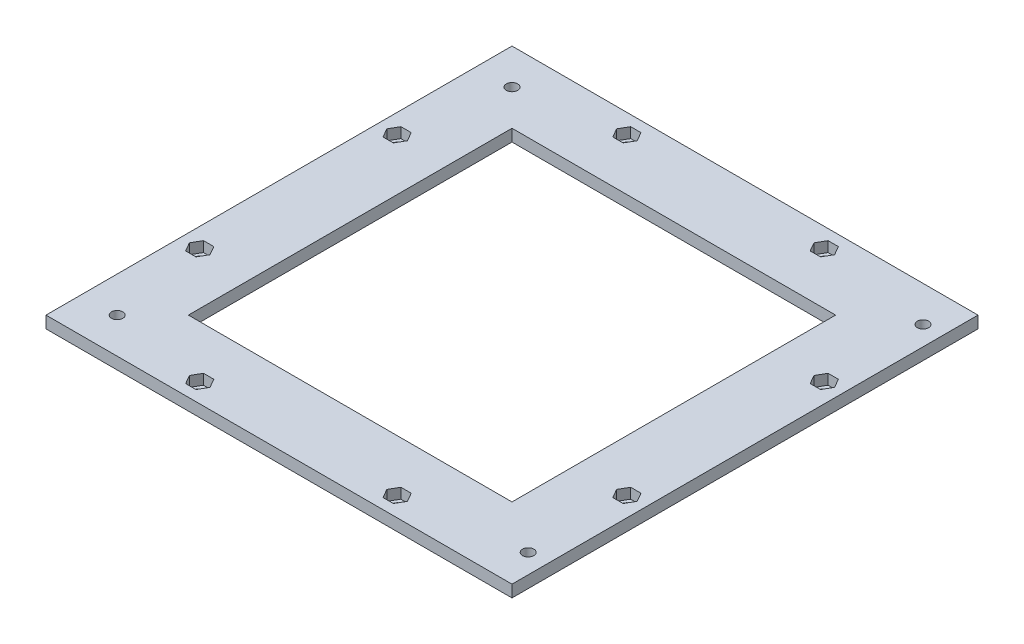
from build123d import *

# Parameters (mm, degrees)
CROQUIS1_W              = 140
CROQUIS1_H              = 140
CROQUIS1_R              = 1.5
SALIENTE_EXTRUIR1_DEPTH = 0.5
CROQUIS2_R              = 1.75
CROQUIS2_W              = 100
CROQUIS2_H              = 100
CORTAR_EXTRUIR1_DEPTH   = 10
SALIENTE_EXTRUIR3_START = 2.7
CROQUIS3_W              = 144
CROQUIS3_H              = 144
CROQUIS3_R              = 1.75
CROQUIS3_W_2            = 100
CROQUIS3_H_2            = 100
SALIENTE_EXTRUIR3_DEPTH = 2.7
CROQUIS4_W              = 144
CROQUIS4_H              = 144
CROQUIS4_W_2            = 140
CROQUIS4_H_2            = 140
SALIENTE_EXTRUIR4_DEPTH = 0.5
CROQUIS5_W              = 144
CROQUIS5_H              = 144
CROQUIS5_R              = 1.75
CROQUIS5_W_2            = 100
CROQUIS5_H_2            = 100
SALIENTE_EXTRUIR5_DEPTH = 0.5


with BuildPart() as part:
    # Croquis1 → Saliente-Extruir1 (new body)
    with BuildSketch(Plane(origin=(0, 0, 0), x_dir=(1, 0, 0), z_dir=(0, 1, 0))):
        Rectangle(CROQUIS1_W, CROQUIS1_H)
        with Locations(Location((-61, 61, 0), (0, 0, 270))):
            Circle(CROQUIS1_R, mode=Mode.SUBTRACT)
        with Locations(Location((66, 61, 0), (0, 0, 270))):
            Circle(CROQUIS1_R, mode=Mode.SUBTRACT)
        with Locations(Location((66, -61, 0), (0, 0, 270))):
            Circle(CROQUIS1_R, mode=Mode.SUBTRACT)
        with Locations(Location((-61, -61, 0), (0, 0, 270))):
            Circle(CROQUIS1_R, mode=Mode.SUBTRACT)
        with Locations(Location((66, 30.5, 0), (0, 0, 270))):
            Circle(CROQUIS1_R, mode=Mode.SUBTRACT)
        with Locations(Location((66, -30.5, 0), (0, 0, 270))):
            Circle(CROQUIS1_R, mode=Mode.SUBTRACT)
        with Locations(Location((-30.5, -66, 0), (0, 0, 270))):
            Circle(CROQUIS1_R, mode=Mode.SUBTRACT)
        with Locations(Location((30.5, -66, 0), (0, 0, 270))):
            Circle(CROQUIS1_R, mode=Mode.SUBTRACT)
        with Locations(Location((-30.5, 66, 0), (0, 0, 90))):
            Circle(CROQUIS1_R, mode=Mode.SUBTRACT)
        with Locations(Location((30.5, 66, 0), (0, 0, 90))):
            Circle(CROQUIS1_R, mode=Mode.SUBTRACT)
        with Locations(Location((-66, 30.5, 0), (0, 0, 90))):
            Circle(CROQUIS1_R, mode=Mode.SUBTRACT)
        with Locations(Location((-66, -30.5, 0), (0, 0, 90))):
            Circle(CROQUIS1_R, mode=Mode.SUBTRACT)
    extrude(amount=SALIENTE_EXTRUIR1_DEPTH)

    # Croquis2 → Cortar-Extruir1 (cut)
    with BuildSketch(Plane(origin=(0, 0.5, 0), x_dir=(1, 0, 0), z_dir=(0, 1, 0))):
        with Locations(Location((66, 61, 0), (0, 0, 270))):
            Circle(CROQUIS2_R)
        with Locations(Location((-61, 61, 0), (0, 0, 270))):
            Circle(CROQUIS2_R)
        with Locations(Location((-61, -61, 0), (0, 0, 270))):
            Circle(CROQUIS2_R)
        with Locations(Location((66, -61, 0), (0, 0, 270))):
            Circle(CROQUIS2_R)
        Polygon((-28.906513257, 63.24), (-27.313026514, 66), (-28.906513257, 68.76), (-32.093486743, 68.76), (-33.686973486, 66), (-32.093486743, 63.24), align=None)
        Polygon((32.093486743, 63.24), (33.686973486, 66), (32.093486743, 68.76), (28.906513257, 68.76), (27.313026514, 66), (28.906513257, 63.24), align=None)
        Polygon((67.593486743, 27.74), (69.186973486, 30.5), (67.593486743, 33.26), (64.406513257, 33.26), (62.813026514, 30.5), (64.406513257, 27.74), align=None)
        Polygon((67.593486743, -33.26), (69.186973486, -30.5), (67.593486743, -27.74), (64.406513257, -27.74), (62.813026514, -30.5), (64.406513257, -33.26), align=None)
        Polygon((32.093486743, -68.76), (33.686973486, -66), (32.093486743, -63.24), (28.906513257, -63.24), (27.313026514, -66), (28.906513257, -68.76), align=None)
        Polygon((-28.906513257, -68.76), (-27.313026514, -66), (-28.906513257, -63.24), (-32.093486743, -63.24), (-33.686973486, -66), (-32.093486743, -68.76), align=None)
        Polygon((-64.406513257, -33.26), (-62.813026514, -30.5), (-64.406513257, -27.74), (-67.593486743, -27.74), (-69.186973486, -30.5), (-67.593486743, -33.26), align=None)
        Polygon((-64.406513257, 27.74), (-62.813026514, 30.5), (-64.406513257, 33.26), (-67.593486743, 33.26), (-69.186973486, 30.5), (-67.593486743, 27.74), align=None)
        Rectangle(CROQUIS2_W, CROQUIS2_H)
    extrude(amount=-CORTAR_EXTRUIR1_DEPTH, mode=Mode.SUBTRACT)

    # Croquis3 → Saliente-Extruir3 (add)
    with BuildSketch(Plane(origin=(0, 0.5, 0), x_dir=(1, 0, 0), z_dir=(0, 1, 0)).offset(SALIENTE_EXTRUIR3_START)):
        Rectangle(CROQUIS3_W, CROQUIS3_H)
        with Locations(Location((-61, -61, 0), (0, 0, 270))):
            Circle(CROQUIS3_R, mode=Mode.SUBTRACT)
        with Locations(Location((-61, 61, 0), (0, 0, 270))):
            Circle(CROQUIS3_R, mode=Mode.SUBTRACT)
        with Locations(Location((66, 61, 0), (0, 0, 270))):
            Circle(CROQUIS3_R, mode=Mode.SUBTRACT)
        with Locations(Location((66, -61, 0), (0, 0, 270))):
            Circle(CROQUIS3_R, mode=Mode.SUBTRACT)
        Rectangle(CROQUIS3_W_2, CROQUIS3_H_2, mode=Mode.SUBTRACT)
        Polygon((-33.686973486, -66), (-32.093486743, -68.76), (-28.906513257, -68.76), (-27.313026514, -66), (-28.906513257, -63.24), (-32.093486743, -63.24), align=None, mode=Mode.SUBTRACT)
        Polygon((-67.593486743, -33.26), (-64.406513257, -33.26), (-62.813026514, -30.5), (-64.406513257, -27.74), (-67.593486743, -27.74), (-69.186973486, -30.5), align=None, mode=Mode.SUBTRACT)
        Polygon((28.906513257, 63.24), (32.093486743, 63.24), (33.686973486, 66), (32.093486743, 68.76), (28.906513257, 68.76), (27.313026514, 66), align=None, mode=Mode.SUBTRACT)
        Polygon((-33.686973486, 66), (-32.093486743, 63.24), (-28.906513257, 63.24), (-27.313026514, 66), (-28.906513257, 68.76), (-32.093486743, 68.76), align=None, mode=Mode.SUBTRACT)
        Polygon((62.813026514, 30.5), (64.406513257, 27.74), (67.593486743, 27.74), (69.186973486, 30.5), (67.593486743, 33.26), (64.406513257, 33.26), align=None, mode=Mode.SUBTRACT)
        Polygon((67.593486743, -33.26), (69.186973486, -30.5), (67.593486743, -27.74), (64.406513257, -27.74), (62.813026514, -30.5), (64.406513257, -33.26), align=None, mode=Mode.SUBTRACT)
        Polygon((33.686973486, -66), (32.093486743, -63.24), (28.906513257, -63.24), (27.313026514, -66), (28.906513257, -68.76), (32.093486743, -68.76), align=None, mode=Mode.SUBTRACT)
        Polygon((-64.406513257, 27.74), (-62.813026514, 30.5), (-64.406513257, 33.26), (-67.593486743, 33.26), (-69.186973486, 30.5), (-67.593486743, 27.74), align=None, mode=Mode.SUBTRACT)
    extrude(amount=-SALIENTE_EXTRUIR3_DEPTH)

    # Croquis4 → Saliente-Extruir4 (add)
    with BuildSketch(Plane.XZ.offset(-0.5)):
        Rectangle(CROQUIS4_W, CROQUIS4_H)
        Rectangle(CROQUIS4_W_2, CROQUIS4_H_2, mode=Mode.SUBTRACT)
    extrude(amount=SALIENTE_EXTRUIR4_DEPTH)

    # Croquis5 → Saliente-Extruir5 (add)
    with BuildSketch(Plane.XZ):
        Rectangle(CROQUIS5_W, CROQUIS5_H)
        with Locations(Location((66, -61, 0), (0, 0, 90))):
            Circle(CROQUIS5_R, mode=Mode.SUBTRACT)
        with Locations(Location((-61, -61, 0), (0, 0, 90))):
            Circle(CROQUIS5_R, mode=Mode.SUBTRACT)
        with Locations(Location((66, 61, 0), (0, 0, 90))):
            Circle(CROQUIS5_R, mode=Mode.SUBTRACT)
        with Locations(Location((-61, 61, 0), (0, 0, 90))):
            Circle(CROQUIS5_R, mode=Mode.SUBTRACT)
        with Locations(Location((66, 30.5, 0), (0, 0, 270))):
            Circle(CROQUIS5_R, mode=Mode.SUBTRACT)
        with Locations(Location((30.5, 66, 0), (0, 0, 270))):
            Circle(CROQUIS5_R, mode=Mode.SUBTRACT)
        with Locations(Location((-30.5, 66, 0), (0, 0, 270))):
            Circle(CROQUIS5_R, mode=Mode.SUBTRACT)
        with Locations(Location((-66, 30.5, 0), (0, 0, 270))):
            Circle(CROQUIS5_R, mode=Mode.SUBTRACT)
        with Locations(Location((-66, -30.5, 0), (0, 0, 270))):
            Circle(CROQUIS5_R, mode=Mode.SUBTRACT)
        with Locations(Location((-30.5, -66, 0), (0, 0, 270))):
            Circle(CROQUIS5_R, mode=Mode.SUBTRACT)
        with Locations(Location((30.5, -66, 0), (0, 0, 270))):
            Circle(CROQUIS5_R, mode=Mode.SUBTRACT)
        with Locations(Location((66, -30.5, 0), (0, 0, 270))):
            Circle(CROQUIS5_R, mode=Mode.SUBTRACT)
        Rectangle(CROQUIS5_W_2, CROQUIS5_H_2, mode=Mode.SUBTRACT)
    extrude(amount=SALIENTE_EXTRUIR5_DEPTH)


solid = part.part
